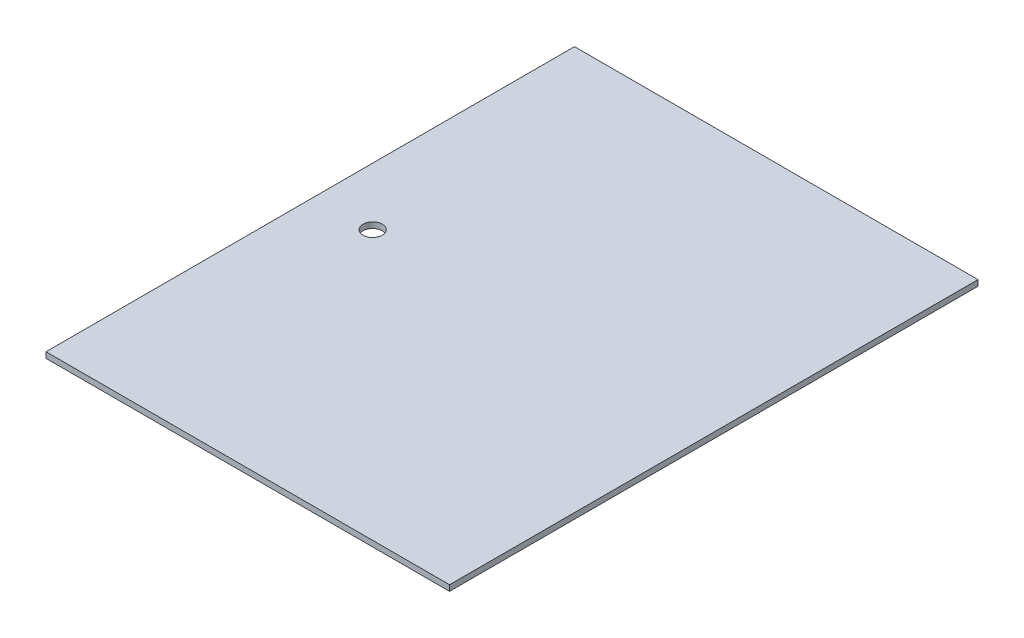
from build123d import *

# Parameters (mm, degrees)
SKETCH1_W           = 210
SKETCH1_H           = 275
BOSS_EXTRUDE1_DEPTH = 3
SKETCH2_R           = 5
CUT_EXTRUDE1_DEPTH  = 3


with BuildPart() as part:
    # Sketch1 → Boss-Extrude1 (new body)
    with BuildSketch(Plane(origin=(0, 0, 0), x_dir=(1, 0, 0), z_dir=(0, 1, 0))):
        with Locations((30.287768387, 61.978610644)):
            Rectangle(SKETCH1_W, SKETCH1_H)
    extrude(amount=BOSS_EXTRUDE1_DEPTH)

    # Sketch2 → Cut-Extrude1 (cut)
    with BuildSketch(Plane(origin=(0, 3, 0), x_dir=(1, 0, 0), z_dir=(0, 1, 0))):
        with Locations(Location((-44.712231613, 64.478610644, 0), (0, 0, 270))):
            Circle(SKETCH2_R)
    extrude(amount=-CUT_EXTRUDE1_DEPTH, mode=Mode.SUBTRACT)


solid = part.part
